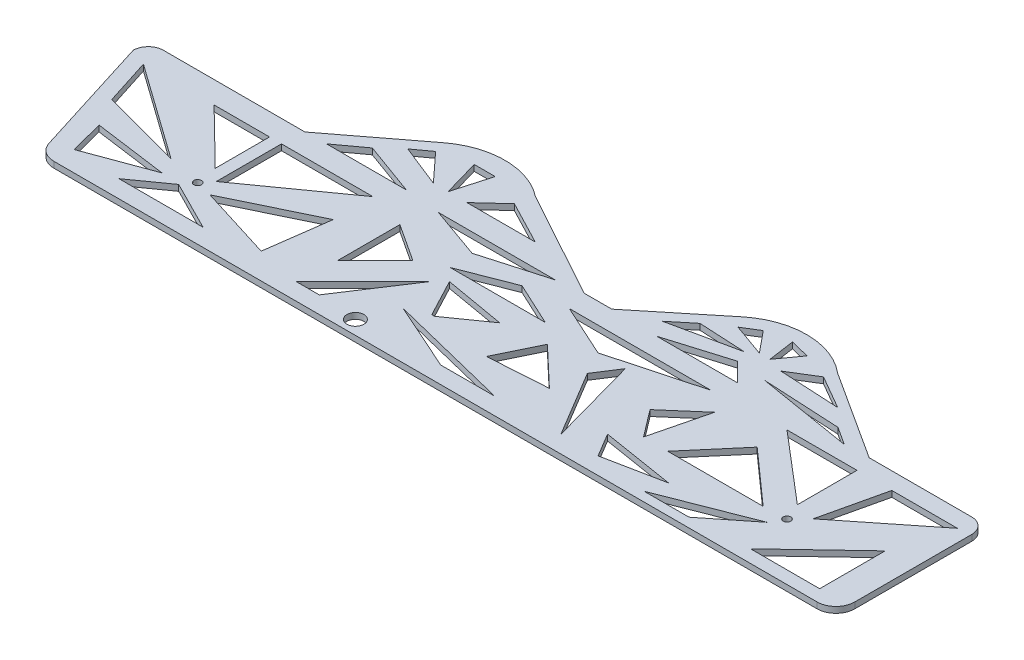
from build123d import *

# Parameters (mm, degrees)
SKETCH1_R           = 2
SKETCH1_R_2         = 4.313560469
SKETCH1_R_3         = 4.5
SKETCH1_R_4         = 3.716178426
BOSS_EXTRUDE1_DEPTH = 3.175
SKETCH2_W           = 597.466303312
SKETCH2_H           = 60.972543052
CUT_EXTRUDE1_DEPTH  = 70
FILLET1_R           = 10
FILLET2_R           = 10
SKETCH6_R           = 40
BOSS_EXTRUDE2_DEPTH = 3.175
BOSS_EXTRUDE3_DEPTH = 3.175
SKETCH9_R           = 40
BOSS_EXTRUDE4_DEPTH = 3.175
BOSS_EXTRUDE6_DEPTH = 3.175
CUT_EXTRUDE2_DEPTH  = 10
CUT_EXTRUDE3_DEPTH  = 10
CUT_EXTRUDE4_DEPTH  = 10
CUT_EXTRUDE5_DEPTH  = 10
CUT_EXTRUDE6_DEPTH  = 10


with BuildPart() as part:
    # Sketch1 → Boss-Extrude1 (new body)
    with BuildSketch(Plane(origin=(0, 0, 0), x_dir=(1, 0, 0), z_dir=(0, 1, 0))):
        with BuildLine():
            ThreePointArc((8, 150), (2.343145751, 147.656854249), (0, 142))
            Line((0, 142), (42, 8))
            ThreePointArc((42, 8), (44.343145751, 2.343145751), (50, 0))
            Line((50, 0), (436.5, 0))
            ThreePointArc((436.5, 0), (442.156854249, 2.343145751), (444.5, 8))
            Line((444.5, 8), (444.5, 142))
            ThreePointArc((444.5, 142), (442.156854249, 147.656854249), (436.5, 150))
            Line((436.5, 150), (336.748623665, 150))
            ThreePointArc((336.748623665, 150), (334.106475607, 148.038018595), (331.46432755, 150))
            Line((331.46432755, 150), (8, 150))
        make_face()
        with Locations(Location((388.475756445, 100.077126905, 0), (0, 0, 270))):
            Circle(SKETCH1_R, mode=Mode.SUBTRACT)
        with Locations(Location((307.606475607, 140.710564477, 0), (0, 0, 270))):
            Circle(SKETCH1_R_2, mode=Mode.SUBTRACT)
        with Locations(Location((77.821750814, 98.327219393, 0), (0, 0, 270))):
            Circle(SKETCH1_R, mode=Mode.SUBTRACT)
        with Locations(Location((182.429479385, 77.355745695, 0), (0, 0, 270))):
            Circle(SKETCH1_R_3, mode=Mode.SUBTRACT)
        with Locations(Location((146.269370224, 139.84039861, 0), (0, 0, 270))):
            Circle(SKETCH1_R_4, mode=Mode.SUBTRACT)
    extrude(amount=BOSS_EXTRUDE1_DEPTH)

    # Sketch2 → Cut-Extrude1 (cut)
    with BuildSketch(Plane.XY):
        with Locations((220.1785332, 7.544358636)):
            Rectangle(SKETCH2_W, SKETCH2_H)
    extrude(amount=-CUT_EXTRUDE1_DEPTH, mode=Mode.SUBTRACT)

    # Fillet1
    fillet1_edges = [part.edges().sort_by_distance(p)[0] for p in [
        (22.567164179, 1.5875, -70),
    ]]
    fillet(fillet1_edges, radius=FILLET1_R)

    # Fillet2
    fillet2_edges = [part.edges().sort_by_distance(p)[0] for p in [
        (444.5, 1.5875, -70),
    ]]
    fillet(fillet2_edges, radius=FILLET2_R)

    # Sketch6 → Boss-Extrude2 (add)
    with BuildSketch(Plane(origin=(0, 0, 0), x_dir=(1, 0, 0), z_dir=(0, 1, 0))):
        with Locations((149, 150.04039861)):
            Circle(SKETCH6_R)
    extrude(amount=BOSS_EXTRUDE2_DEPTH)

    # Sketch7 → Boss-Extrude3 (add)
    with BuildSketch(Plane(origin=(0, 0, 0), x_dir=(1, 0, 0), z_dir=(0, 1, 0))):
        Polygon((124.164543783, 181.396420591), (82.702881078, 149.750534228), (231.468946681, 149.750534228), (173.835456217, 181.396420591), align=None)
    extrude(amount=BOSS_EXTRUDE3_DEPTH)

    # Sketch9 → Boss-Extrude4 (add)
    with BuildSketch(Plane(origin=(0, 0, 0), x_dir=(1, 0, 0), z_dir=(0, 1, 0))):
        with BuildLine():
            ThreePointArc((269, 150), (272.870833001, 167.166341835), (283.734164599, 181.010281545))
            Line((283.734164599, 181.010281545), (245.673378314, 150))
            Line((245.673378314, 150), (269, 150))
        make_face()
        with Locations((309, 150)):
            Circle(SKETCH9_R)
    extrude(amount=BOSS_EXTRUDE4_DEPTH)

    # Sketch12 → Boss-Extrude6 (add)
    with BuildSketch(Plane(origin=(0, 0, 0), x_dir=(1, 0, 0), z_dir=(0, 1, 0))):
        Polygon((326.166341835, 186.129166999), (382.106475607, 150), (340.398839744, 150), align=None)
    extrude(amount=BOSS_EXTRUDE6_DEPTH)

    # Sketch13 → Cut-Extrude2 (cut)
    with BuildSketch(Plane(origin=(0, 3.175, 0), x_dir=(1, 0, 0), z_dir=(0, 1, 0))):
        Polygon((126.596630185, 175.699600472), (118.071388699, 169.473803102), (140.590780828, 160.520909874), align=None)
        Polygon((142.805778665, 179.955358976), (153.92453015, 179.955358976), (148.365154407, 160.520909874), align=None)
        Polygon((158.369799386, 160.520909874), (171.45690463, 172.586701787), (194.594159282, 160.520909874), align=None)
        Polygon((108.223756098, 160.520909874), (94.177153866, 150.262983529), (136.512601507, 150.262983529), align=None)
        Polygon((155.324532982, 148.431005589), (192.465847063, 148.431005589), (217.292214981, 148.431005589), (183.025531956, 138.62875365), align=None)
    extrude(amount=-CUT_EXTRUDE2_DEPTH, mode=Mode.SUBTRACT)

    # Sketch14 → Cut-Extrude3 (cut)
    with BuildSketch(Plane(origin=(0, 3.175, 0), x_dir=(1, 0, 0), z_dir=(0, 1, 0))):
        Polygon((287.387365491, 175.190284075), (295.66806948, 180.292754759), (305.015851869, 168.900328202), align=None)
        Polygon((308.630084677, 182.834690248), (318.900148429, 180.292754759), (310.630809682, 168.900328202), align=None)
        Polygon((318.900148429, 166.379196716), (332.89720101, 175.004012981), (350.750845105, 164.702889414), align=None)
        Polygon((300.341960675, 165.541043065), (275.583975015, 166.844059842), (264.607664644, 157.837711611), align=None)
        Polygon((318.900148429, 157.837711611), (359.859445758, 155.682017188), (369.45606502, 149.484000906), align=None)
        Polygon((302.829713803, 159.399721535), (270.095819829, 149.484000906), (312.697737902, 149.484000906), align=None)
    extrude(amount=-CUT_EXTRUDE3_DEPTH, mode=Mode.SUBTRACT)

    # Sketch15 → Cut-Extrude4 (cut)
    with BuildSketch(Plane(origin=(0, 3.175, 0), x_dir=(1, 0, 0), z_dir=(0, 1, 0))):
        Polygon((9.082536395, 138.332869462), (16.951784082, 113.666673792), (59.847245845, 102.198186546), align=None)
        Polygon((46.527345648, 138.332869462), (75.932780446, 138.332869462), (75.932780446, 109.552219535), align=None)
        Polygon((82.275228769, 103.765733182), (130.726352108, 138.332869462), (82.275228769, 138.332869462), align=None)
        Polygon((25.252080853, 98.620149784), (30.014206453, 80.800449194), (63.923719137, 93.326510285), align=None)
        Polygon((73.651734719, 92.462114854), (55.153094423, 79.264381219), (99.755557686, 79.264381219), align=None)
        Polygon((86.703646203, 95.973330035), (130.726352108, 117.260863799), (126.131589339, 83.694731493), align=None)
    extrude(amount=-CUT_EXTRUDE4_DEPTH, mode=Mode.SUBTRACT)

    # Sketch16 → Cut-Extrude5 (cut)
    with BuildSketch(Plane(origin=(0, 3.175, 0), x_dir=(1, 0, 0), z_dir=(0, 1, 0))):
        Polygon((437.892195527, 140.994591207), (395.306902067, 107.113261781), (403.121369003, 140.994591207), align=None)
        Polygon((384.654839472, 93.268223937), (361.655164528, 74.969428739), (337.798732838, 74.969428739), align=None)
        Polygon((429.106942721, 111.483374831), (392.46021732, 76.762265555), (429.106942721, 76.762265555), align=None)
        Polygon((384.654839472, 140.994591207), (347.551515413, 140.994591207), (384.654839472, 109.39285335), align=None)
        Polygon((347.551515413, 125.193722279), (325.746359439, 99.592479337), (376.307639908, 99.592479337), align=None)
    extrude(amount=-CUT_EXTRUDE5_DEPTH, mode=Mode.SUBTRACT)

    # Sketch17 → Cut-Extrude6 (cut)
    with BuildSketch(Plane(origin=(0, 3.175, 0), x_dir=(1, 0, 0), z_dir=(0, 1, 0))):
        Polygon((234.14639503, 139.026116815), (309.197820801, 139.026116815), (262.118798526, 126.26771918), align=None)
        Polygon((211.155668978, 136.962371774), (183.727319265, 126.26771918), (234.14639503, 126.26771918), align=None)
        Polygon((150.710604994, 132.646917997), (150.710604994, 99.742633834), (170.588020135, 119.620048974), align=None)
        Polygon((150.710604994, 80.176001915), (184.553616381, 114.019013303), (161.611869132, 79.012701862), (149.369026486, 79.012701862), align=None)
        Polygon((190.022281375, 95.03260673), (225.996651018, 79.012701862), (254.545180422, 79.012701862), align=None)
        Polygon((200.527414873, 99.742633834), (190.022281375, 119.620048974), (222.283730898, 114.019013303), (202.008756576, 99.742633834), align=None)
        Polygon((244.72715064, 116.819531138), (234.14639503, 95.03260673), (265.507593925, 97.097507609), align=None)
        Polygon((268.717573549, 114.019013303), (289.655742431, 79.012701862), (276.569858899, 126.26771918), align=None)
        Polygon((301.929754413, 114.019013303), (320.262459356, 129.915538559), (312.771055987, 99.742633834), align=None)
        Polygon((301.929754413, 91.509886863), (309.404639922, 79.012701862), (340.535394318, 85.261294363), align=None)
    extrude(amount=-CUT_EXTRUDE6_DEPTH, mode=Mode.SUBTRACT)


solid = part.part
